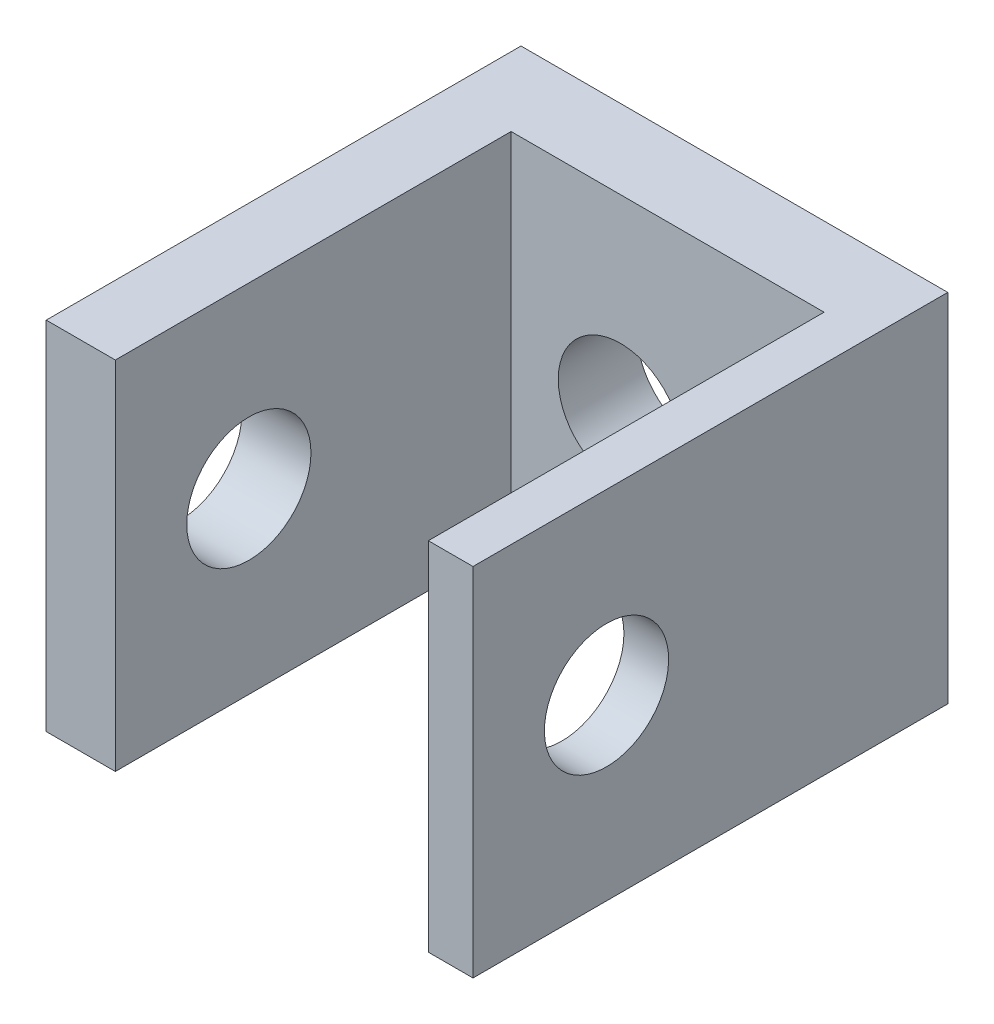
from build123d import *

# Parameters (mm, degrees)
SKETCH1_W           = 17.180000002
SKETCH1_H           = 14.347137423
SKETCH1_R           = 2.5
BOSS_EXTRUDE1_DEPTH = 3.18
SKETCH2_W           = 1.798380988
SKETCH2_H           = 14.347137423
SKETCH2_W_2         = 2.781619014
BOSS_EXTRUDE2_DEPTH = 15.932476
SKETCH3_R           = 2.5
CUT_EXTRUDE1_DEPTH  = 27.822965215


with BuildPart() as part:
    # Sketch1 → Boss-Extrude1 (new body)
    with BuildSketch(Plane.XY):
        with Locations((1.409999999, 0.509680861)):
            Rectangle(SKETCH1_W, SKETCH1_H)
        with Locations(Location((0, 0, 0), (0, 0, 180))):
            Circle(SKETCH1_R, mode=Mode.SUBTRACT)
    extrude(amount=BOSS_EXTRUDE1_DEPTH)

    # Sketch2 → Boss-Extrude2 (add)
    with BuildSketch(Plane.XY.offset(3.18)):
        with Locations((9.100809506, 0.509680861)):
            Rectangle(SKETCH2_W, SKETCH2_H)
        with Locations((-5.789190495, 0.509680861)):
            Rectangle(SKETCH2_W_2, SKETCH2_H)
    extrude(amount=BOSS_EXTRUDE2_DEPTH)

    # Sketch3 → Cut-Extrude1 (cut, through all)
    with BuildSketch(Plane(origin=(10, 0, 0), x_dir=(0, 0, -1), z_dir=(1, 0, 0))):
        with Locations(Location((-13.737500001, 0.50968086, 0), (0, 0, 90))):
            Circle(SKETCH3_R)
    extrude(amount=-CUT_EXTRUDE1_DEPTH, mode=Mode.SUBTRACT)


solid = part.part
